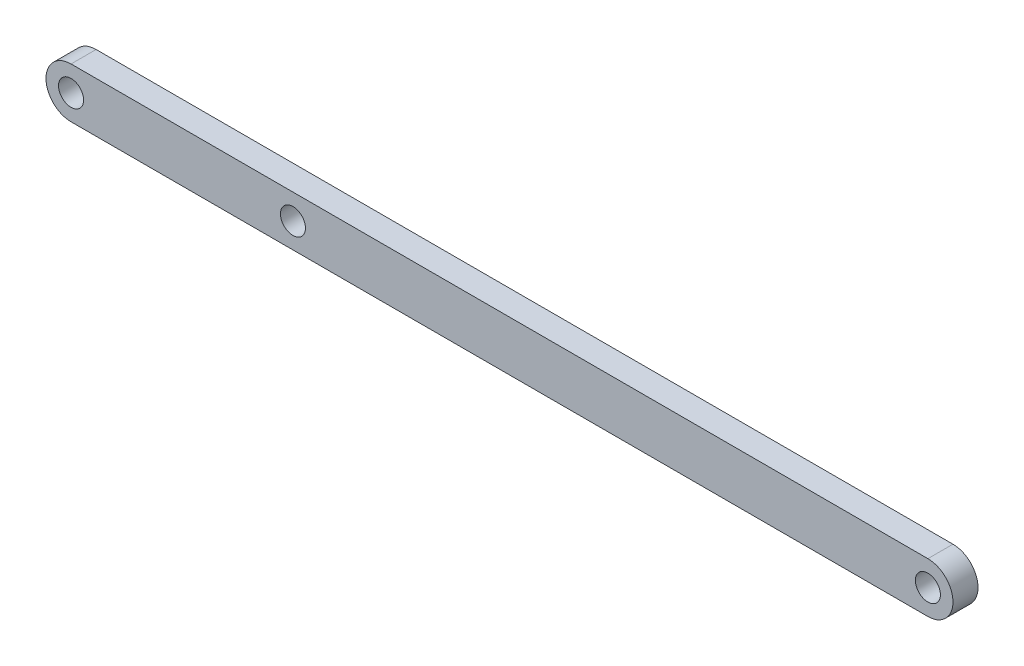
from build123d import *

# Parameters (mm, degrees)
ESBO_O1_R                = 2.5
RESSALTO_EXTRUS_O1_DEPTH = 5


with BuildPart() as part:
    # Esboço1 → Ressalto-extrusão1 (new body)
    with BuildSketch(Plane.XY):
        with BuildLine():
            Line((-85.49, 5), (85.49, 5))
            ThreePointArc((85.49, 5), (90.49, 0), (85.49, -5))
            Line((85.49, -5), (-85.49, -5))
            ThreePointArc((-85.49, -5), (-90.49, 0), (-85.49, 5))
        make_face()
        with Locations((-85.49, 0)):
            Circle(ESBO_O1_R, mode=Mode.SUBTRACT)
        with Locations((-41.21, 0)):
            Circle(ESBO_O1_R, mode=Mode.SUBTRACT)
        with Locations((85.49, 0)):
            Circle(ESBO_O1_R, mode=Mode.SUBTRACT)
    extrude(amount=RESSALTO_EXTRUS_O1_DEPTH)


solid = part.part
